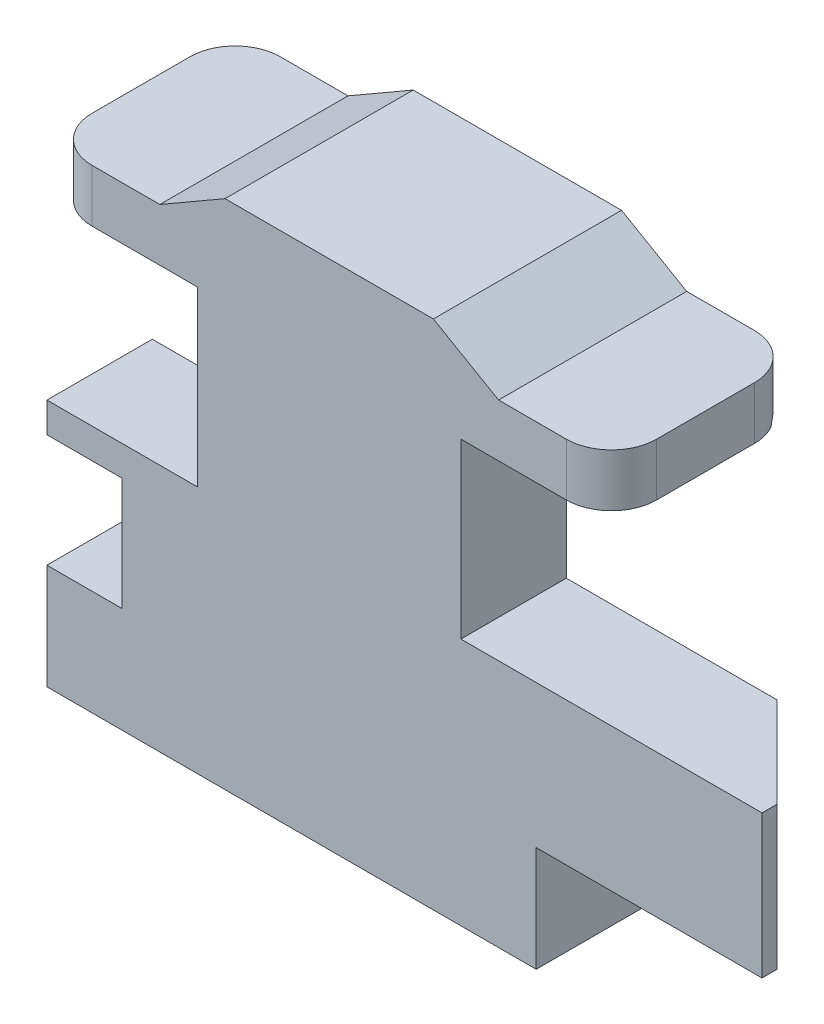
from build123d import *

# Parameters (mm, degrees)
BOSS_EXTRUDE1_DEPTH = 3.8
SKETCH2_W           = 11
SKETCH2_H           = 2.8
BOSS_EXTRUDE2_DEPTH = 7
SKETCH3_W           = 4
SKETCH3_H           = 8.4
CUT_EXTRUDE1_DEPTH  = 43.932622105
SKETCH4_W           = 11
SKETCH4_H           = 2.4
BOSS_EXTRUDE3_DEPTH = 2.2
SKETCH5_W           = 5
SKETCH5_H           = 2.4
BOSS_EXTRUDE4_DEPTH = 4
SKETCH6_W           = 9
SKETCH6_H           = 2.8
BOSS_EXTRUDE5_DEPTH = 2.8
SKETCH7_W           = 2.8
SKETCH7_H           = 6.6
BOSS_EXTRUDE6_DEPTH = 4
SKETCH8_W           = 4.732050808
SKETCH8_H           = 1
CUT_EXTRUDE2_DEPTH  = 44.13200715
SKETCH9_W           = 4.732050807
SKETCH9_H           = 1
CUT_EXTRUDE3_DEPTH  = 44.13200715
SKETCH10_W          = 2
SKETCH10_H          = 3
CUT_EXTRUDE4_DEPTH  = 43.932622105
DRAFT1_ANGLE        = 60
CHAMFER1_SIZE       = 0.6
FILLET1_R           = 1.2


with BuildPart() as part:
    # Sketch1 → Boss-Extrude1 (new body)
    with BuildSketch(Plane(origin=(0, 6.6, 0), x_dir=(1, 0, 0), z_dir=(0, 1, 0))):
        Polygon((-21.625238963, 0.4), (-24.025238963, 2.8), (-40.625238963, 2.8), (-40.625238963, 0), (-21.625238963, 0), align=None)
    extrude(amount=-BOSS_EXTRUDE1_DEPTH)

    # Sketch2 → Boss-Extrude2 (add)
    with BuildSketch(Plane(origin=(0, 6.6, 0), x_dir=(-1, 0, 0), z_dir=(0, 1, 0))):
        with Locations((35.125238963, -1.4)):
            Rectangle(SKETCH2_W, SKETCH2_H)
    extrude(amount=BOSS_EXTRUDE2_DEPTH)

    # Sketch3 → Cut-Extrude1 (cut, through all)
    with BuildSketch(Plane.XY):
        with Locations((-38.625238963, 7)):
            Rectangle(SKETCH3_W, SKETCH3_H)
    extrude(amount=-CUT_EXTRUDE1_DEPTH, mode=Mode.SUBTRACT)

    # Sketch4 → Boss-Extrude3 (add)
    with BuildSketch(Plane(origin=(0, 0, -2.8), x_dir=(-1, 0, 0), z_dir=(0, 0, -1))):
        with Locations((35.125238963, 12.4)):
            Rectangle(SKETCH4_W, SKETCH4_H)
    extrude(amount=BOSS_EXTRUDE3_DEPTH)

    # Sketch5 → Boss-Extrude4 (add)
    with BuildSketch(Plane(origin=(-29.625238963, 0, 0), x_dir=(0, 0, -1), z_dir=(1, 0, 0))):
        with Locations((2.5, 12.4)):
            Rectangle(SKETCH5_W, SKETCH5_H)
    extrude(amount=BOSS_EXTRUDE4_DEPTH)

    # Sketch6 → Boss-Extrude5 (add)
    with BuildSketch(Plane.XZ.offset(-2.8)):
        with Locations((-32.125238963, -1.4)):
            Rectangle(SKETCH6_W, SKETCH6_H)
    extrude(amount=BOSS_EXTRUDE5_DEPTH)

    # Sketch7 → Boss-Extrude6 (add)
    with BuildSketch(Plane.ZY.offset(36.625238963)):
        with Locations((-1.4, 3.3)):
            Rectangle(SKETCH7_W, SKETCH7_H)
    extrude(amount=BOSS_EXTRUDE6_DEPTH)

    # Sketch8 → Cut-Extrude2 (cut, through all)
    with BuildSketch(Plane(origin=(0, 0, -5), x_dir=(-1, 0, 0), z_dir=(0, 0, -1))):
        with Locations((38.259213559, 13.1)):
            Rectangle(SKETCH8_W, SKETCH8_H)
    extrude(amount=-CUT_EXTRUDE2_DEPTH, mode=Mode.SUBTRACT)

    # Sketch9 → Cut-Extrude3 (cut, through all)
    with BuildSketch(Plane.XY):
        with Locations((-27.991264367, 13.1)):
            Rectangle(SKETCH9_W, SKETCH9_H)
    extrude(amount=-CUT_EXTRUDE3_DEPTH, mode=Mode.SUBTRACT)

    # Sketch10 → Cut-Extrude4 (cut, through all)
    with BuildSketch(Plane(origin=(0, 0, -2.8), x_dir=(-1, 0, 0), z_dir=(0, 0, -1))):
        with Locations((39.625238963, 4.3)):
            Rectangle(SKETCH10_W, SKETCH10_H)
    extrude(amount=-CUT_EXTRUDE4_DEPTH, mode=Mode.SUBTRACT)

    # Draft1
    draft1_faces = [part.faces().sort_by_distance(p)[0] for p in [
        (-30.35728977, 13.1, -2.5),
        (-35.893188155, 13.1, -2.5),
    ]]
    draft(draft1_faces, Plane.ZX.offset(13.6), DRAFT1_ANGLE)

    # Chamfer1
    chamfer1_edges = [part.edges().sort_by_distance(p)[0] for p in [
        (-33.125238963, 11.2, -5),
    ]]
    chamfer(chamfer1_edges, length=CHAMFER1_SIZE)

    # Fillet1
    fillet1_edges = [part.edges().sort_by_distance(p)[0] for p in [
        (-25.625238963, 12.2, -5),
        (-25.625238963, 11.9, 0),
        (-40.625238963, 12.2, -5),
        (-40.625238963, 11.9, 0),
    ]]
    fillet(fillet1_edges, radius=FILLET1_R)


solid = part.part
